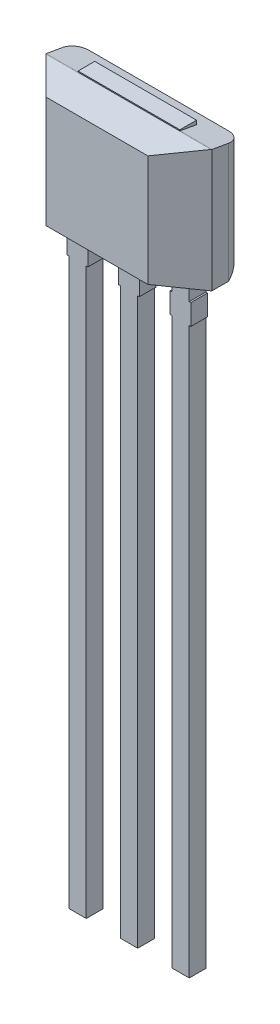
from build123d import *

# Parameters (mm, degrees)
BOSS_EXTRUDE1_DEPTH      = 1.44
BOSS_EXTRUDE1_DEPTH_BACK = 1.58
CUT_EXTRUDE1_START       = -2.045
CUT_EXTRUDE1_DEPTH       = 4.09
SKETCH3_W                = 2.51
SKETCH3_H                = 0.162535045
BOSS_EXTRUDE2_DEPTH      = 0.41
SKETCH4_R                = 0.75
CUT_EXTRUDE2_DEPTH       = 0.025


with BuildPart() as part:
    # Sketch1 → Boss-Extrude1 (new, two sides: drawn at the far end of the back side and taken through both)
    with BuildSketch(Plane(origin=(0, 0, 0), x_dir=(1, 0, 0), z_dir=(0, 1, 0)).offset(-BOSS_EXTRUDE1_DEPTH_BACK)):
        with BuildLine():
            Line((-2.045, 0), (-1.255, -0.79))
            Line((-1.255, -0.79), (1.255, -0.79))
            Line((1.255, -0.79), (2.045, 0))
            Line((2.045, 0), (2.045, 0.41))
            ThreePointArc((2.045, 0.41), (1.95127417, 0.63627417), (1.725, 0.73))
            Line((1.725, 0.73), (-1.725, 0.73))
            ThreePointArc((-1.725, 0.73), (-1.95127417, 0.63627417), (-2.045, 0.41))
            Line((-2.045, 0.41), (-2.045, 0))
        make_face()
    extrude(amount=BOSS_EXTRUDE1_DEPTH + BOSS_EXTRUDE1_DEPTH_BACK)

    # Sketch2 → Cut-Extrude1 (cut)
    with BuildSketch(Plane(origin=(0, 0, 0), x_dir=(0, 0, -1), z_dir=(1, 0, 0)).offset(CUT_EXTRUDE1_START)):
        Polygon((0.41, -1.58), (0.73, -1.58), (0.73, -1.26), align=None)
        Polygon((-0.01, 1.44), (-0.79, 1.44), (-0.79, 1.302464955), align=None)
        Polygon((-0.01, -1.58), (-0.79, -1.442464955), (-0.79, -1.58), align=None)
        Polygon((0.73, 1.311281304), (0.73, 1.44), (0, 1.44), align=None)
    extrude(amount=CUT_EXTRUDE1_DEPTH, mode=Mode.SUBTRACT)

    # Sketch3 → Boss-Extrude2 (add)
    with BuildSketch(Plane.XY):
        Polygon((1.485, -1.58), (1.055, -1.58), (1.055, -2.09), (1.015, -2.09), (1.015, -2.6), (1.055, -2.6), (1.055, -16.53), (1.485, -16.53), (1.485, -2.6), (1.525, -2.6), (1.525, -2.09), (1.485, -2.09), align=None)
        Polygon((0.215, -1.58), (-0.215, -1.58), (-0.215, -2.09), (-0.255, -2.09), (-0.255, -2.6), (-0.215, -2.6), (-0.215, -16.53), (0.215, -16.53), (0.215, -2.6), (0.255, -2.6), (0.255, -2.09), (0.215, -2.09), align=None)
        Polygon((-1.055, -1.58), (-1.485, -1.58), (-1.485, -2.09), (-1.525, -2.09), (-1.525, -2.6), (-1.485, -2.6), (-1.485, -16.53), (-1.055, -16.53), (-1.055, -2.6), (-1.015, -2.6), (-1.015, -2.09), (-1.055, -2.09), align=None)
        with Locations((0, 1.383732478)):
            Rectangle(SKETCH3_W, SKETCH3_H)
    extrude(amount=-BOSS_EXTRUDE2_DEPTH)

    # Sketch4 → Cut-Extrude2 (cut)
    with BuildSketch(Plane(origin=(0, 0, -0.73), x_dir=(-1, 0, 0), z_dir=(0, 0, -1))):
        with Locations((0, 0.025640652)):
            Circle(SKETCH4_R)
    extrude(amount=-CUT_EXTRUDE2_DEPTH, mode=Mode.SUBTRACT)


solid = part.part
